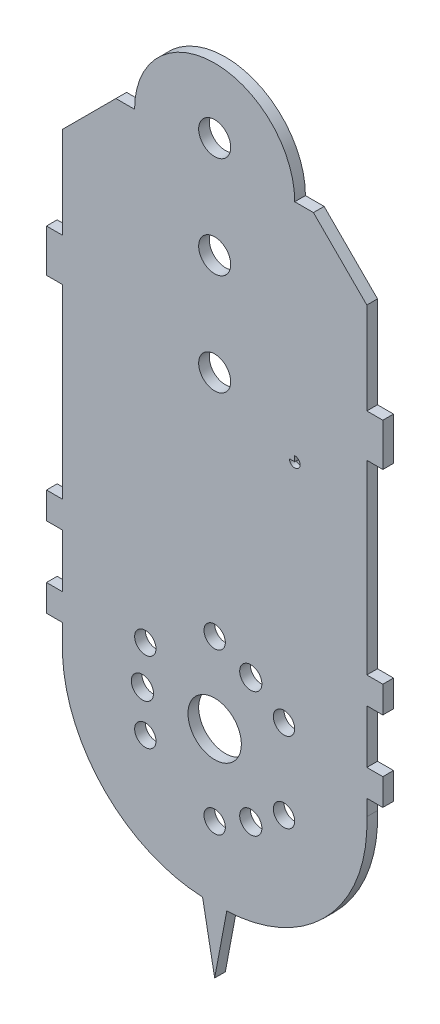
from build123d import *

# Parameters (mm, degrees)
SKETCH_1_R          = 2
SKETCH_1_R_2        = 2.08
SKETCH_1_R_3        = 5
SKETCH_1_R_4        = 3
EXTRUDE_1_DEPTH     = 2
CUT_EXTRUDE_1_DEPTH = 1


with BuildPart() as part:
    # 草图1 → 凸台-拉伸1 (new body)
    with BuildSketch(Plane.XY):
        with BuildLine():
            Line((26.233844386, -52.574512395), (29.233844386, -52.574512395))
            Line((29.233844386, -52.574512395), (29.233844386, -47.574512395))
            Line((29.233844386, -47.574512395), (26.233844386, -47.574512395))
            Line((26.233844386, -47.574512395), (26.233844386, -12.754512395))
            Line((26.233844386, -12.754512395), (29.233844386, -12.754512395))
            Line((29.233844386, -12.754512395), (29.233844386, -4.754512395))
            Line((29.233844386, -4.754512395), (26.233844386, -4.754512395))
            Line((26.233844386, -4.754512395), (26.233844386, -4.654512395))
            Line((26.233844386, -4.654512395), (26.233844386, 12.425487605))
            Line((26.233844386, 12.425487605), (16.233844386, 22.425487605))
            Line((16.233844386, 22.425487605), (12.733844386, 22.425487605))
            ThreePointArc((12.733844386, 22.425487605), (-2.266155614, 37.425487605), (-17.266155614, 22.425487605))
            Line((-17.266155614, 22.425487605), (-20.766155614, 22.425487605))
            Line((-20.766155614, 22.425487605), (-30.766155614, 12.425487605))
            Line((-30.766155614, 12.425487605), (-30.766155614, -4.654512395))
            Line((-30.766155614, -4.654512395), (-30.766155614, -4.754512395))
            Line((-30.766155614, -4.754512395), (-33.766155614, -4.754512395))
            Line((-33.766155614, -4.754512395), (-33.766155614, -12.754512395))
            Line((-33.766155614, -12.754512395), (-30.766155614, -12.754512395))
            Line((-30.766155614, -12.754512395), (-30.766155614, -47.574512395))
            Line((-30.766155614, -47.574512395), (-33.766155614, -47.574512395))
            Line((-33.766155614, -47.574512395), (-33.766155614, -52.574512395))
            Line((-33.766155614, -52.574512395), (-30.766155614, -52.574512395))
            Line((-30.766155614, -52.574512395), (-30.766155614, -54.574512395))
            Line((-30.766155614, -54.574512395), (-30.766155614, -57.574512395))
            Line((-30.766155614, -57.574512395), (-30.766155614, -62.574512395))
            Line((-30.766155614, -62.574512395), (-33.766155614, -62.574512395))
            Line((-33.766155614, -62.574512395), (-33.766155614, -67.574512395))
            Line((-33.766155614, -67.574512395), (-30.766155614, -67.574512395))
            Line((-30.766155614, -67.574512395), (-30.766155614, -70.574512395))
            ThreePointArc((-30.766155614, -70.574512395), (-23.533087643, -90.212600129), (-4.532311227, -98.984273724))
            Line((-4.532311227, -98.984273724), (-2.266155614, -110.984273724))
            Line((-2.266155614, -110.984273724), (0, -98.984273724))
            ThreePointArc((0, -98.984273724), (19.000776416, -90.212600129), (26.233844386, -70.574512395))
            Line((26.233844386, -70.574512395), (26.233844386, -67.574512395))
            Line((26.233844386, -67.574512395), (29.233844386, -67.574512395))
            Line((29.233844386, -67.574512395), (29.233844386, -62.574512395))
            Line((29.233844386, -62.574512395), (26.233844386, -62.574512395))
            Line((26.233844386, -62.574512395), (26.233844386, -57.574512395))
            Line((26.233844386, -57.574512395), (26.233844386, -54.574512395))
            Line((26.233844386, -54.574512395), (26.233844386, -52.574512395))
        make_face()
        with Locations((-2.266155614, -85.571739483)):
            Circle(SKETCH_1_R, mode=Mode.SUBTRACT)
        with Locations((-15.254135258, -78.073125939)):
            Circle(SKETCH_1_R, mode=Mode.SUBTRACT)
        with Locations((-15.254135258, -63.075898852)):
            Circle(SKETCH_1_R, mode=Mode.SUBTRACT)
        with Locations((-2.266155614, -55.577285308)):
            Circle(SKETCH_1_R, mode=Mode.SUBTRACT)
        with Locations((10.721824031, -63.075898852)):
            Circle(SKETCH_1_R, mode=Mode.SUBTRACT)
        with Locations((10.721824031, -78.073125939)):
            Circle(SKETCH_1_R, mode=Mode.SUBTRACT)
        with Locations((-15.796155614, -70.574512395)):
            Circle(SKETCH_1_R_2, mode=Mode.SUBTRACT)
        with Locations((4.498844386, -58.857188682)):
            Circle(SKETCH_1_R_2, mode=Mode.SUBTRACT)
        with Locations((4.498844386, -82.291836109)):
            Circle(SKETCH_1_R_2, mode=Mode.SUBTRACT)
        with Locations((-2.266155614, -70.574512395)):
            Circle(SKETCH_1_R_3, mode=Mode.SUBTRACT)
        with Locations((-2.266155614, -12.754512395)):
            Circle(SKETCH_1_R_4, mode=Mode.SUBTRACT)
        with Locations((-2.266155614, 6.245487605)):
            Circle(SKETCH_1_R_4, mode=Mode.SUBTRACT)
        with Locations((-2.266155614, 25.245487605)):
            Circle(SKETCH_1_R_4, mode=Mode.SUBTRACT)
    extrude(amount=EXTRUDE_1_DEPTH)

    # 草图2 → 切除-拉伸1 (cut)
    with BuildSketch(Plane.XY.offset(2)):
        with BuildLine():
            Line((12.733844386, -19.749278663), (11.733844386, -19.749278663))
            ThreePointArc((11.733844386, -19.749278663), (12.733844386, -20.749278663), (13.733844386, -19.749278663))
            ThreePointArc((13.733844386, -19.749278663), (13.440951168, -19.042171882), (12.733844386, -18.749278663))
            Line((12.733844386, -18.749278663), (12.733844386, -19.749278663))
        make_face()
    extrude(amount=-CUT_EXTRUDE_1_DEPTH, mode=Mode.SUBTRACT)


solid = part.part
